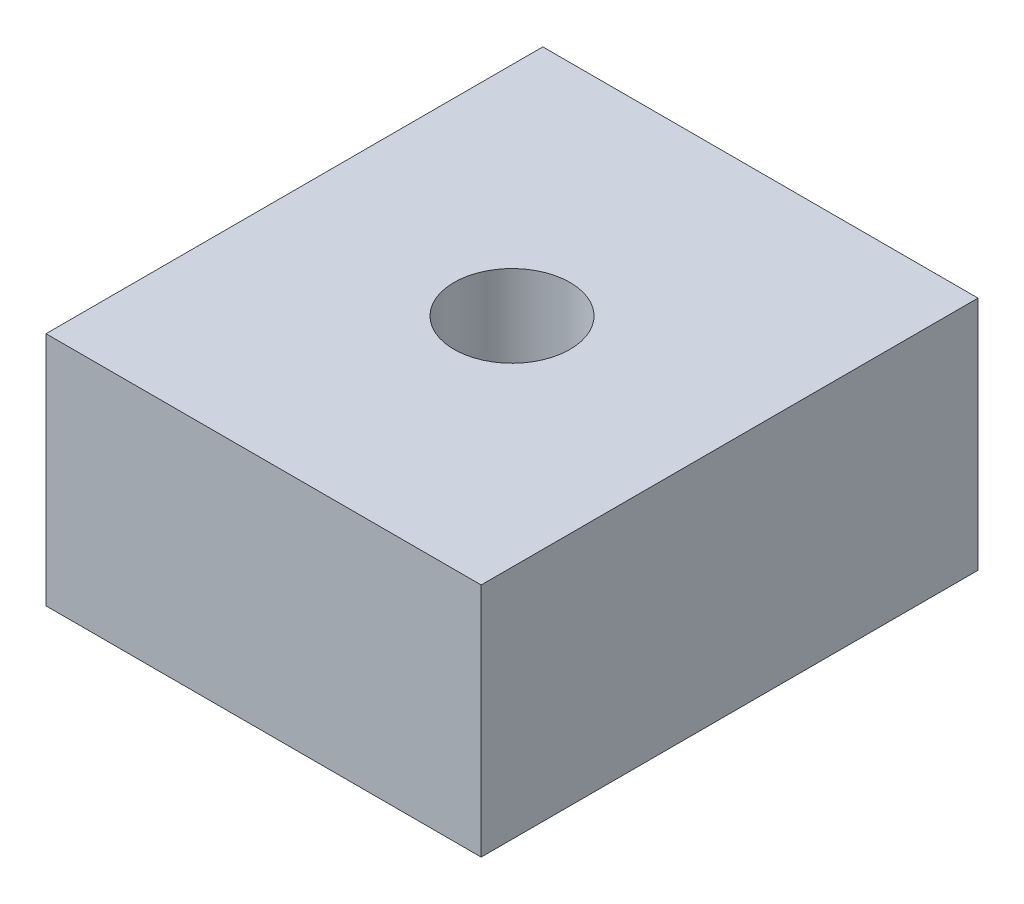
from build123d import *

# Parameters (mm, degrees)
SKETCH4_W               = 12
SKETCH4_H               = 13.7
BOSS_EXTRUDE2_DEPTH     = 6.5
CUT_EXTRUDE1_DEPTH      = 3
CUT_EXTRUDE2_DEPTH      = 12.188051662
CUT_EXTRUDE2_DEPTH_BACK = 12.188051662
SKETCH5_R               = 1.6


with BuildPart() as part:
    # Sketch4 → Boss-Extrude2 (new body)
    with BuildSketch(Plane(origin=(0, 0, 0), x_dir=(1, 0, 0), z_dir=(0, 1, 0))):
        Rectangle(SKETCH4_W, SKETCH4_H)
    extrude(amount=BOSS_EXTRUDE2_DEPTH)

    # Sketch3 → Cut-Extrude1 (cut)
    with BuildSketch(Plane.XZ):
        Polygon((1.638566399, -2.920348179), (3.348378911, -0.041133962), (1.709812512, 2.879214217), (-1.638566399, 2.920348179), (-3.348378911, 0.041133962), (-1.709812512, -2.879214217), align=None)
    extrude(amount=-CUT_EXTRUDE1_DEPTH, mode=Mode.SUBTRACT)

    # Sketch5 → Cut-Extrude2 (cut, two sides: drawn at the far end of the back side and taken through both)
    with BuildSketch(Plane.XZ.offset(-CUT_EXTRUDE2_DEPTH_BACK)):
        with Locations(Location((0, 0, 0), (0, 0, 270))):
            Circle(SKETCH5_R)
    extrude(amount=CUT_EXTRUDE2_DEPTH + CUT_EXTRUDE2_DEPTH_BACK, mode=Mode.SUBTRACT)


solid = part.part
